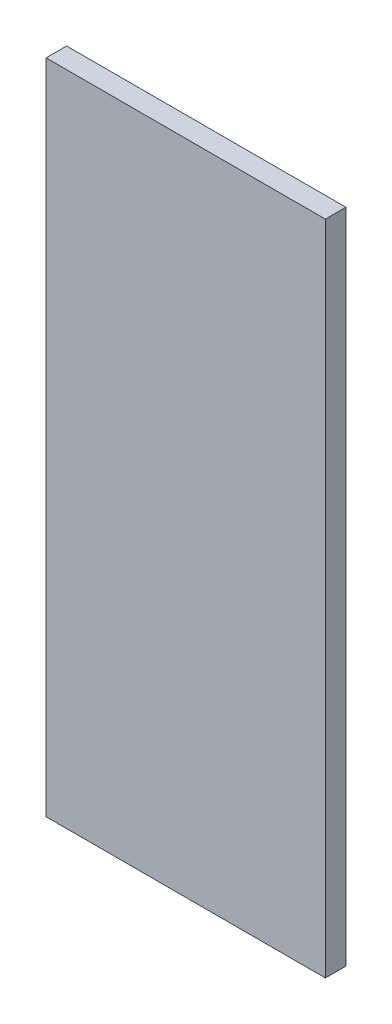
from build123d import *

# Parameters (mm, degrees)
SKETCH1_W           = 21.59
SKETCH1_H           = 50.8
BOSS_EXTRUDE1_DEPTH = 1.5875


with BuildPart() as part:
    # Sketch1 → Boss-Extrude1 (new body)
    with BuildSketch(Plane.XY):
        Rectangle(SKETCH1_W, SKETCH1_H)
    extrude(amount=BOSS_EXTRUDE1_DEPTH)


solid = part.part
